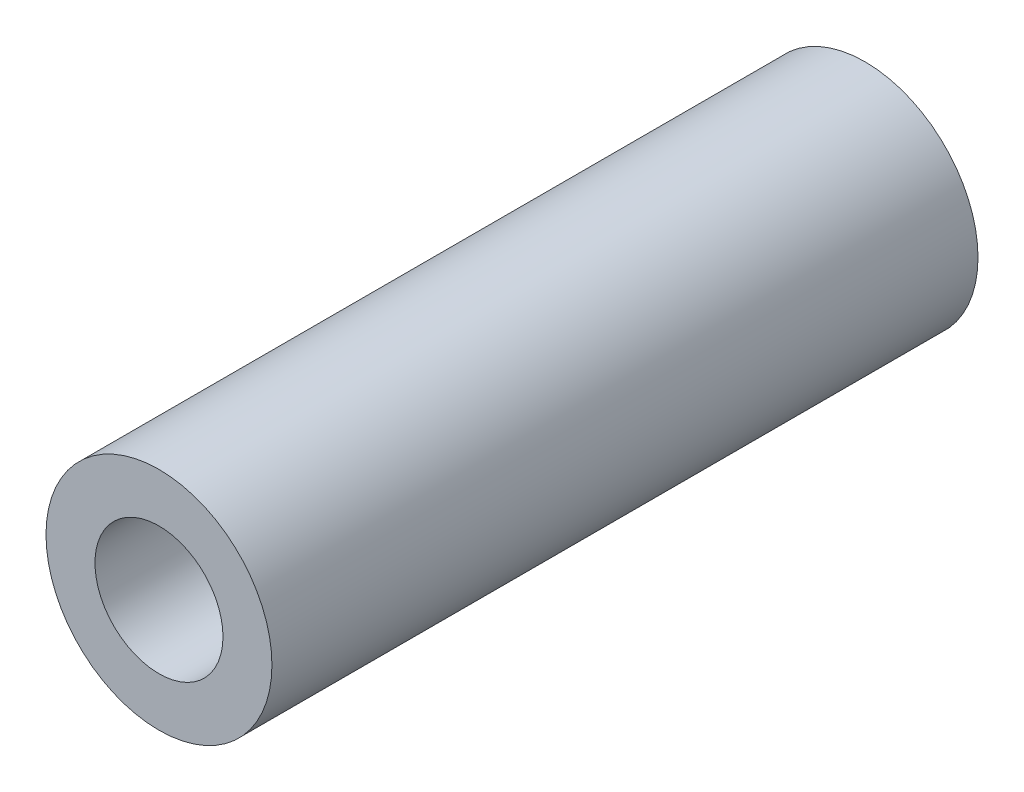
from build123d import *

# Parameters (mm, degrees)
SKETCH1_R           = 6
SKETCH1_R_2         = 3.4
BOSS_EXTRUDE1_DEPTH = 37.5


with BuildPart() as part:
    # Sketch1 → Boss-Extrude1 (new body)
    with BuildSketch(Plane.XY):
        with Locations((1.959493634, 6.335e-06)):
            Circle(SKETCH1_R)
        with Locations((1.959493634, 6.335e-06)):
            Circle(SKETCH1_R_2, mode=Mode.SUBTRACT)
    extrude(amount=-BOSS_EXTRUDE1_DEPTH)


solid = part.part
